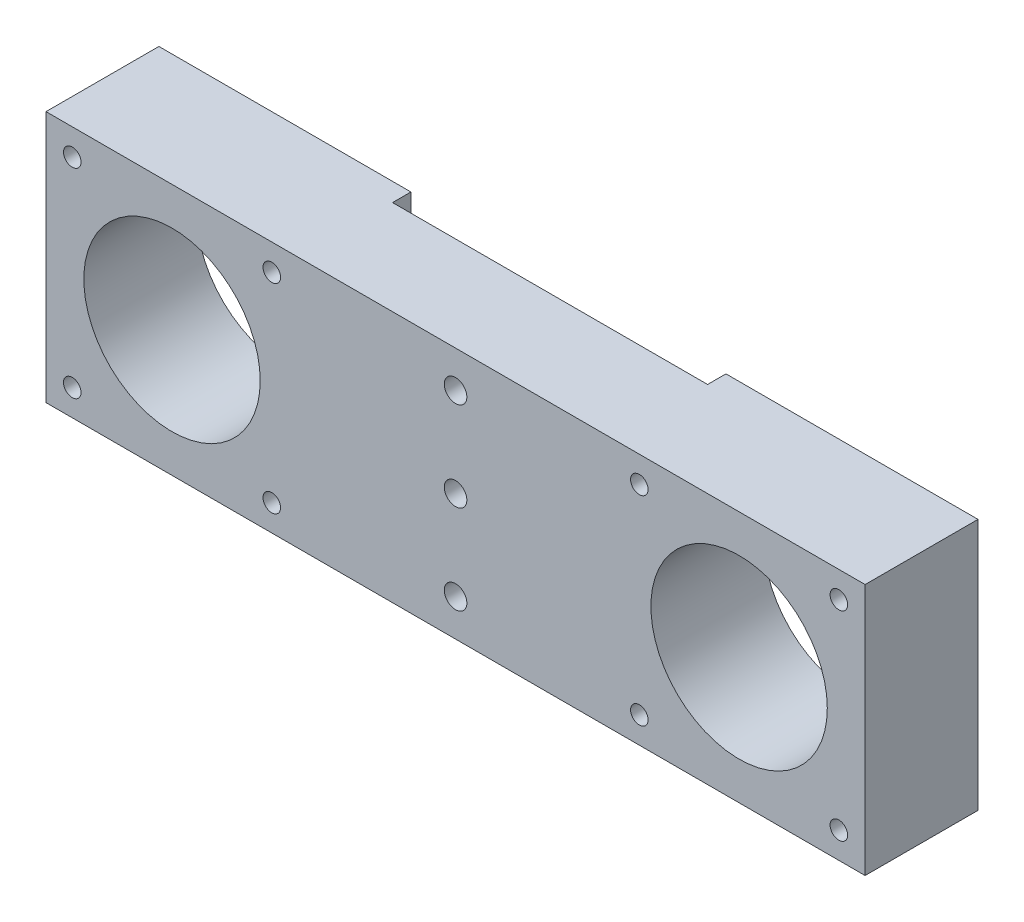
from build123d import *

# Parameters (mm, degrees)
SKETCH_1_W             = 48
SKETCH_1_H             = 48
SKETCH_1_R             = 16.8
SKETCH_1_R_2           = 1.67
EXTRUDE_1_DEPTH        = 21.5
SKETCH_3_W             = 60
SKETCH_3_H             = 48
SKETCH_3_R             = 2.15
EXTRUDE_2_DEPTH        = 18
PATTERN_LINEAR_2_COUNT = 2
PATTERN_LINEAR_2_PITCH = 108


with BuildPart() as part:
    # 草图1 → 凸台-拉伸1 (new body)
    with BuildSketch(Plane.XY):
        Rectangle(SKETCH_1_W, SKETCH_1_H)
        Circle(SKETCH_1_R, mode=Mode.SUBTRACT)
        with Locations((-19, 19)):
            Circle(SKETCH_1_R_2, mode=Mode.SUBTRACT)
        with Locations((19, 19)):
            Circle(SKETCH_1_R_2, mode=Mode.SUBTRACT)
        with Locations((19, -19)):
            Circle(SKETCH_1_R_2, mode=Mode.SUBTRACT)
        with Locations((-19, -19)):
            Circle(SKETCH_1_R_2, mode=Mode.SUBTRACT)
    extrude_1 = extrude(amount=EXTRUDE_1_DEPTH)

    # 草图3 → 凸台-拉伸2 (add)
    with BuildSketch(Plane.XY.offset(21.5)):
        with Locations((54, 0)):
            Rectangle(SKETCH_3_W, SKETCH_3_H)
        with Locations((54, 17)):
            Circle(SKETCH_3_R, mode=Mode.SUBTRACT)
        with Locations((54, 0)):
            Circle(SKETCH_3_R, mode=Mode.SUBTRACT)
        with Locations((54, -17)):
            Circle(SKETCH_3_R, mode=Mode.SUBTRACT)
    extrude(amount=-EXTRUDE_2_DEPTH)

    # 阵列(线性)2: 凸台-拉伸1 ×2
    with Locations(*[(i * PATTERN_LINEAR_2_PITCH, 0, 0) for i in range(1, PATTERN_LINEAR_2_COUNT)]):
        add(extrude_1)


solid = part.part
